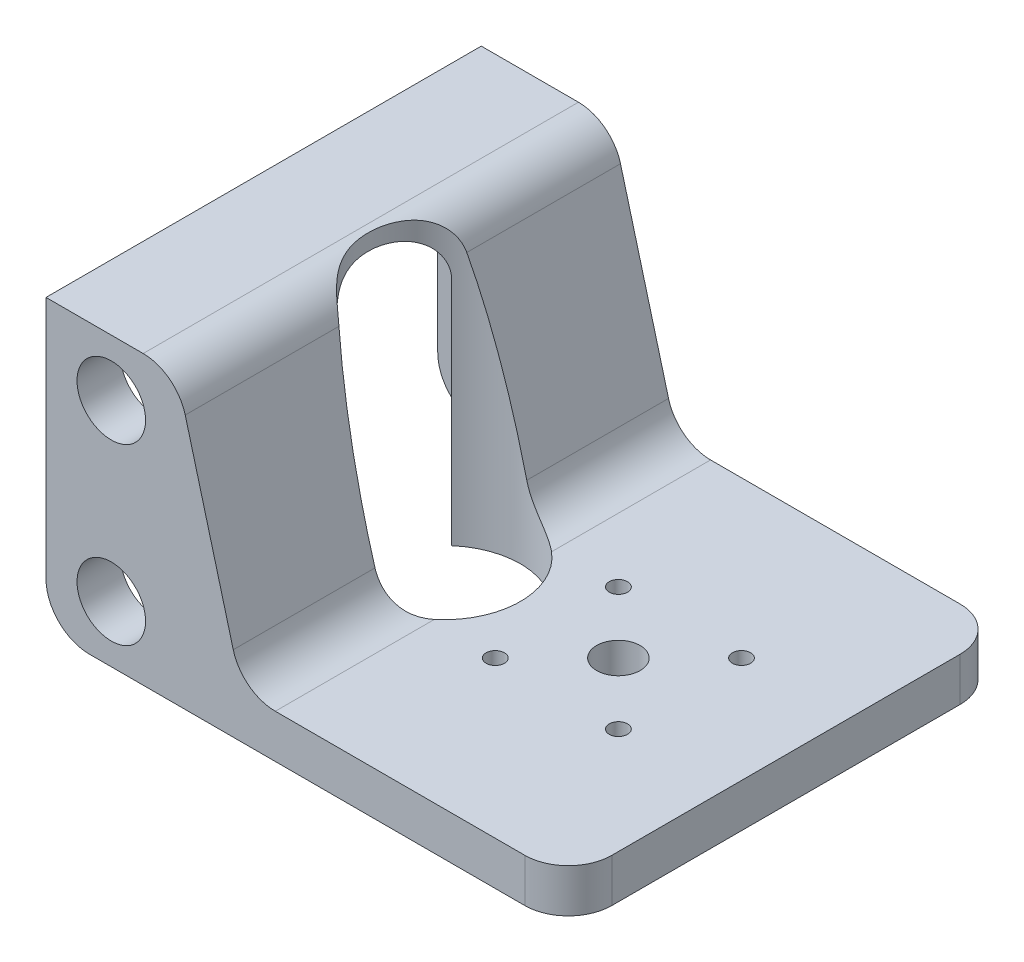
from build123d import *

# Parameters (mm, degrees)
SKETCH1_W             = 30
SKETCH1_H             = 66
SKETCH1_R             = 7.875
BOSS_EXTRUDE1_DEPTH   = 50
SKETCH2_W             = 80
SKETCH2_H             = 63
CUT_EXTRUDE1_DEPTH    = 79.797208072
BOSS_EXTRUDE2_DEPTH   = 100
SKETCH5_R             = 5
CUT_EXTRUDE2_DEPTH    = 130.077496102
M5X0_8_TAPPED_HOLE1_D = 4.2
FILLET1_R             = 10
SKETCH10_R            = 17.5
CUT_EXTRUDE3_DEPTH    = 134.719856416


with BuildPart() as part:
    # Sketch1 → Boss-Extrude1 (new, symmetric)
    with BuildSketch(Plane.XY):
        with Locations((0, -20)):
            Rectangle(SKETCH1_W, SKETCH1_H)
        Circle(SKETCH1_R, mode=Mode.SUBTRACT)
        with Locations((0, -40)):
            Circle(SKETCH1_R, mode=Mode.SUBTRACT)
    extrude(amount=BOSS_EXTRUDE1_DEPTH, both=True)

    # Sketch2 → Cut-Extrude1 (cut, through all)
    with BuildSketch(Plane(origin=(15, 0, 0), x_dir=(0, 0, -1), z_dir=(1, 0, 0))):
        with Locations((0, -21.5)):
            Rectangle(SKETCH2_W, SKETCH2_H)
    extrude(amount=-CUT_EXTRUDE1_DEPTH, mode=Mode.SUBTRACT)

    # Sketch4 → Boss-Extrude2 (add)
    with BuildSketch(Plane.XY.offset(50)):
        Polygon((15, 13), (30.005154776, -43), (105, -43), (105, -53), (15, -53), align=None)
    extrude(amount=-BOSS_EXTRUDE2_DEPTH)

    # Sketch5 → Cut-Extrude2 (cut, through all)
    with BuildSketch(Plane(origin=(0, -43, 0), x_dir=(1, 0, 0), z_dir=(0, 1, 0))):
        with Locations(Location((66.5, 0, 0), (0, 0, 270))):
            Circle(SKETCH5_R)
    extrude(amount=-CUT_EXTRUDE2_DEPTH, mode=Mode.SUBTRACT)

    # M5x0.8 Tapped Hole1 (through all)
    with Locations(Plane(origin=(0, -43, 0), x_dir=(1, 0, 0), z_dir=(0, 1, 0))):
        with Locations((80.642135624, 14.142135624), (80.642135624, -14.142135624), (52.357864376, 14.142135624), (52.357864376, -14.142135624)):
            Hole(M5X0_8_TAPPED_HOLE1_D / 2)

    # Fillet1
    fillet1_edges = [part.edges().sort_by_distance(p)[0] for p in [
        (15, 13, 0),
        (30.005154776, -43, 0),
        (105, -48, 50),
        (105, -48, -50),
        (-15, -53, -45),
        (-15, -53, 45),
        (15, 10, 0),
    ]]
    fillet(fillet1_edges, radius=FILLET1_R)

    # Sketch10 → Cut-Extrude3 (cut, through all)
    with BuildSketch(Plane(origin=(0, 13, 0), x_dir=(1, 0, 0), z_dir=(0, 1, 0))):
        with Locations(Location((26.5, 0, 0), (0, 0, 274.980086745))):
            Circle(SKETCH10_R)
    extrude(amount=-CUT_EXTRUDE3_DEPTH, mode=Mode.SUBTRACT)


solid = part.part
